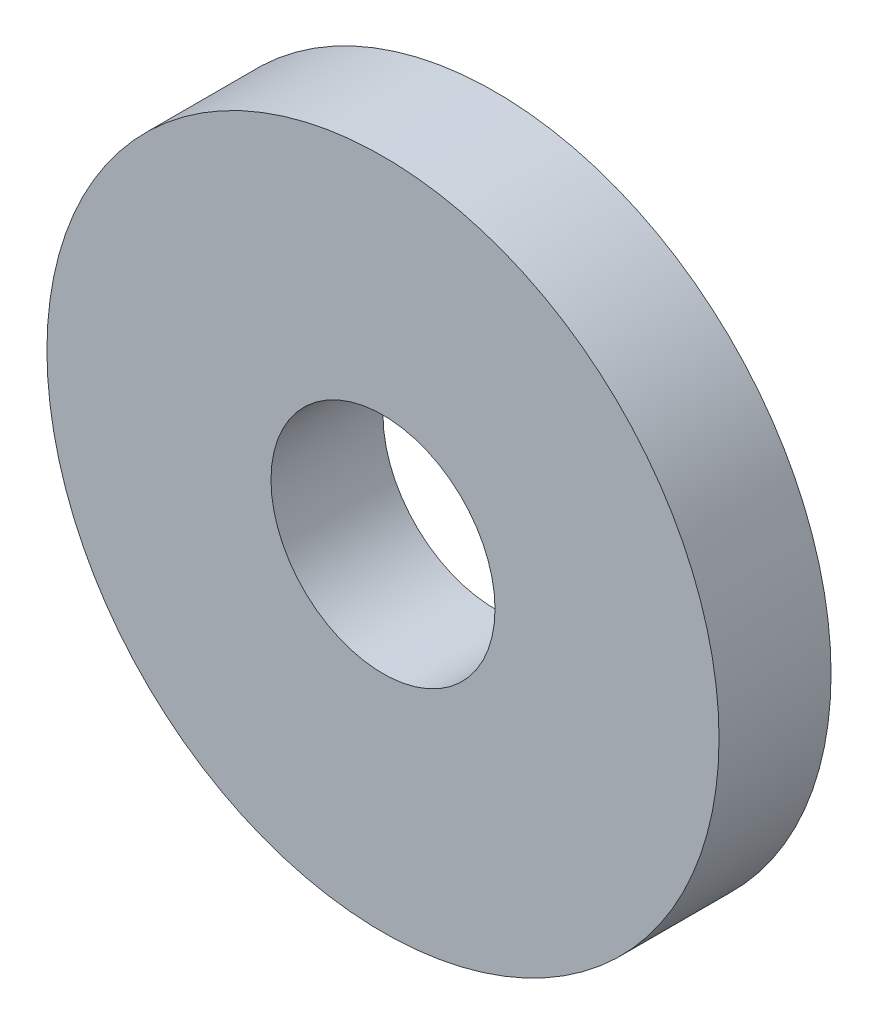
from build123d import *

# Parameters (mm, degrees)
SKETCH_1_R          = 30
EXTRUDE_1_DEPTH     = 10
SKETCH_2_R          = 20
SKETCH_2_R_2        = 15
CUT_EXTRUDE_1_DEPTH = 7
SKETCH_3_R          = 10
CUT_EXTRUDE_2_DEPTH = 10


with BuildPart() as part:
    # 草图1 → 凸台-拉伸1 (new body)
    with BuildSketch(Plane.XY):
        Circle(SKETCH_1_R)
    extrude(amount=EXTRUDE_1_DEPTH)

    # 草图2 → 切除-拉伸1 (cut)
    with BuildSketch(Plane.XY):
        Circle(SKETCH_2_R)
        Circle(SKETCH_2_R_2, mode=Mode.SUBTRACT)
    extrude(amount=CUT_EXTRUDE_1_DEPTH, mode=Mode.SUBTRACT)

    # 草图3 → 切除-拉伸2 (cut)
    with BuildSketch(Plane(origin=(0, 0, 0), x_dir=(-1, 0, 0), z_dir=(0, 0, -1))):
        Circle(SKETCH_3_R)
    extrude(amount=-CUT_EXTRUDE_2_DEPTH, mode=Mode.SUBTRACT)


solid = part.part
